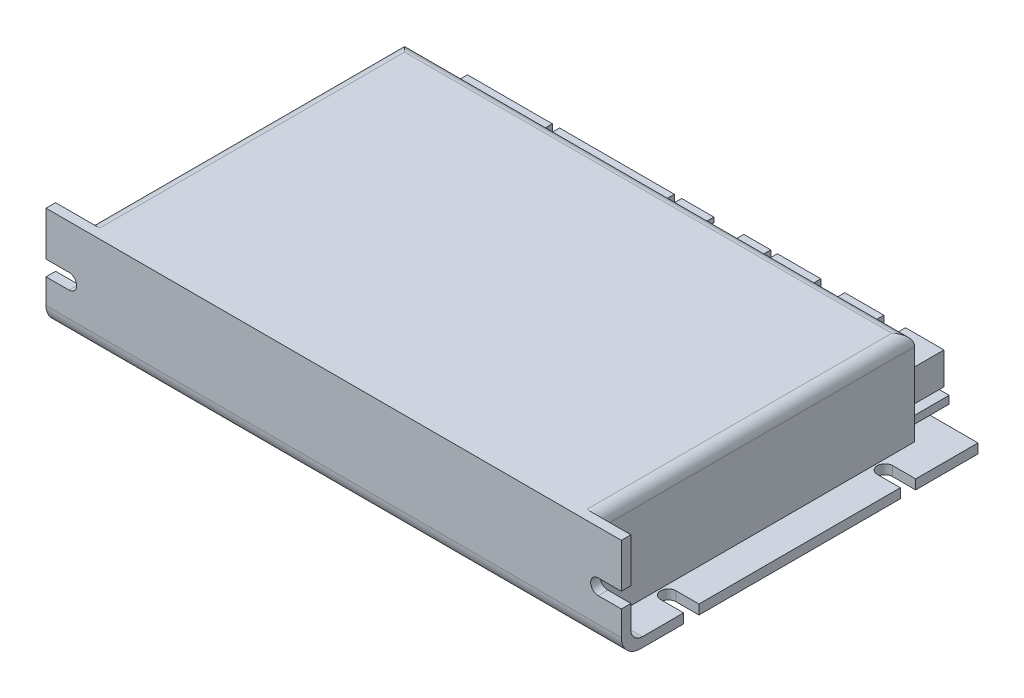
from build123d import *

# Parameters (mm, degrees)
SKETCH1_W           = 150
SKETCH1_H           = 93
EXTRUDE1_DEPTH      = 27
CUT_EXTRUDE1_DEPTH  = 24.5
CUT_EXTRUDE2_DEPTH  = 24.5
CUT_EXTRUDE3_DEPTH  = 24.5
FILLET1_R           = 5
FILLET2_R           = 3
SKETCH5_W           = 131
SKETCH5_H           = 16.5
CUT_EXTRUDE4_DEPTH  = 10
SKETCH6_W           = 14
SKETCH6_H           = 11
SKETCH6_W_2         = 44.5
CUT_EXTRUDE5_DEPTH  = 10
FILLET3_R           = 3
EXTRUDE3_DEPTH      = 1
EXTRUDE3_DEPTH_BACK = 10
SKETCH7_W           = 10
SKETCH7_H           = 7.5
SKETCH7_W_2         = 9.046304271
SKETCH7_W_3         = 9.441343418
SKETCH7_W_4         = 21.25
EXTRUDE6_DEPTH      = 10
EXTRUDE6_DEPTH_BACK = 3
SKETCH8_W           = 131
SKETCH8_H           = 2
SKETCH8_W_2         = 10.022421915
SKETCH8_H_2         = 8.333056229
SKETCH8_W_3         = 22.129060208
SKETCH8_W_4         = 10.185564029
SKETCH8_W_5         = 29.943982186
SKETCH8_W_6         = 11.333887955
SKETCH8_W_7         = 23.227827516
SKETCH9_W           = 2.603467903
SKETCH9_H           = 2.496021275
SKETCH9_W_2         = 2.603467902
CUT_EXTRUDE6_DEPTH  = 4
SKETCH10_W          = 2.603467902
SKETCH10_H          = 2.496021275
SKETCH10_W_2        = 2.603467903
CUT_EXTRUDE7_DEPTH  = 4


with BuildPart() as part:
    # Sketch1 → Extrude1 (new body)
    with BuildSketch(Plane(origin=(0, 0, 0), x_dir=(1, 0, 0), z_dir=(0, 1, 0))):
        with Locations((75, 46.5)):
            Rectangle(SKETCH1_W, SKETCH1_H)
    extrude(amount=EXTRUDE1_DEPTH)

    # Sketch2 → Cut-Extrude1 (cut)
    with BuildSketch(Plane(origin=(0, 27, 0), x_dir=(-1, 0, 0), z_dir=(0, 1, 0))):
        Polygon((-141.5, -93), (-8.5, -93), (0, -93), (0, -2.5), (-8.5, -2.5), (-8.5, -85), (-141.5, -85), (-141.5, -2.5), (-150, -2.5), (-150, -93), align=None)
    extrude(amount=-CUT_EXTRUDE1_DEPTH, mode=Mode.SUBTRACT)

    # Sketch3 → Cut-Extrude2 (cut)
    with BuildSketch(Plane.XY):
        with BuildLine():
            Line((150, 15.5), (150, 11.5))
            Line((150, 11.5), (144, 11.5))
            ThreePointArc((144, 11.5), (142, 13.5), (144, 15.5))
            Line((144, 15.5), (150, 15.5))
        make_face()
        with BuildLine():
            Line((6, 15.5), (0, 15.5))
            Line((0, 15.5), (0, 11.5))
            Line((0, 11.5), (6, 11.5))
            ThreePointArc((6, 11.5), (8, 13.5), (6, 15.5))
        make_face()
    extrude(amount=-CUT_EXTRUDE2_DEPTH, mode=Mode.SUBTRACT)

    # Sketch4 → Cut-Extrude3 (cut)
    with BuildSketch(Plane.XZ):
        with BuildLine():
            Line((6, -16.25), (0, -16.25))
            Line((0, -16.25), (0, -20.25))
            Line((0, -20.25), (6, -20.25))
            ThreePointArc((6, -20.25), (8, -18.25), (6, -16.25))
        make_face()
        with BuildLine():
            Line((144, -76.75), (150, -76.75))
            Line((150, -76.75), (150, -72.75))
            Line((150, -72.75), (144, -72.75))
            ThreePointArc((144, -72.75), (142, -74.75), (144, -76.75))
        make_face()
        with BuildLine():
            Line((0, -76.75), (0, -72.75))
            Line((0, -72.75), (6, -72.75))
            ThreePointArc((6, -72.75), (8, -74.75), (6, -76.75))
            Line((6, -76.75), (0, -76.75))
        make_face()
        with BuildLine():
            Line((150, -16.25), (150, -20.25))
            Line((150, -20.25), (144, -20.25))
            ThreePointArc((144, -20.25), (142, -18.25), (144, -16.25))
            Line((144, -16.25), (150, -16.25))
        make_face()
    extrude(amount=-CUT_EXTRUDE3_DEPTH, mode=Mode.SUBTRACT)

    # Fillet1
    fillet1_edges = [part.edges().sort_by_distance(p)[0] for p in [
        (75, 0, 0),
    ]]
    fillet(fillet1_edges, radius=FILLET1_R)

    # Fillet2
    fillet2_edges = [part.edges().sort_by_distance(p)[0] for p in [
        (141.5, 27, -43.75),
        (8.5, 27, -43.75),
        (75, 27, -85),
    ]]
    fillet(fillet2_edges, radius=FILLET2_R)

    # Sketch5 → Cut-Extrude4 (cut)
    with BuildSketch(Plane(origin=(0, 0, -85), x_dir=(-1, 0, 0), z_dir=(0, 0, -1))):
        with Locations((-75, 10.75)):
            Rectangle(SKETCH5_W, SKETCH5_H)
    extrude(amount=-CUT_EXTRUDE4_DEPTH, mode=Mode.SUBTRACT)

    # Sketch6 → Cut-Extrude5 (cut)
    with BuildSketch(Plane.ZY.offset(-8.5)):
        with Locations((-72, 13.5)):
            Rectangle(SKETCH6_W, SKETCH6_H)
        with Locations((-30.75, 13.5)):
            Rectangle(SKETCH6_W_2, SKETCH6_H)
    extrude(amount=-CUT_EXTRUDE5_DEPTH, mode=Mode.SUBTRACT)

    # Fillet3
    fillet3_edges = [part.edges().sort_by_distance(p)[0] for p in [
        (145.75, 2.5, -2.5),
        (4.25, 2.5, -2.5),
    ]]
    fillet(fillet3_edges, radius=FILLET3_R)

    # Sketch7 → Extrude3 (add, two sides: drawn at the far end of the back side and taken through both)
    with BuildSketch(Plane.ZY.offset(-8.5).offset(-EXTRUDE3_DEPTH_BACK)):
        with Locations((-72, 12.75)):
            Rectangle(SKETCH7_W, SKETCH7_H)
        with Locations((-47.476847865, 12.75)):
            Rectangle(SKETCH7_W_2, SKETCH7_H)
        with Locations((-36.814452533, 12.75)):
            Rectangle(SKETCH7_W_3, SKETCH7_H)
        with Locations((-20.125, 12.75)):
            Rectangle(SKETCH7_W_4, SKETCH7_H)
    extrude(amount=EXTRUDE3_DEPTH + EXTRUDE3_DEPTH_BACK)

    # Sketch8 → Extrude6 (add, two sides: drawn at the far end of the back side and taken through both)
    with BuildSketch(Plane(origin=(0, 0, -85), x_dir=(-1, 0, 0), z_dir=(0, 0, -1)).offset(-EXTRUDE6_DEPTH_BACK)):
        with Locations((-75, 6.5)):
            Rectangle(SKETCH8_W, SKETCH8_H)
        with Locations((-134.116596711, 12.895075454)):
            Rectangle(SKETCH8_W_2, SKETCH8_H_2)
        with Locations((-25.958034722, 12.895075454)):
            Rectangle(SKETCH8_W_3, SKETCH8_H_2)
        with Locations((-118.373880477, 12.895075454)):
            Rectangle(SKETCH8_W_4, SKETCH8_H_2)
        with Locations((-53.870994704, 12.895075454)):
            Rectangle(SKETCH8_W_5, SKETCH8_H_2)
        with Locations((-101.357677139, 12.895075454)):
            Rectangle(SKETCH8_W_6, SKETCH8_H_2)
        with Locations((-82.352152151, 12.895075454)):
            Rectangle(SKETCH8_W_7, SKETCH8_H_2)
    extrude(amount=EXTRUDE6_DEPTH + EXTRUDE6_DEPTH_BACK)


with BuildPart() as extrude6_piece_1:
    # of the separate pieces the step leaves, piece 1, a body of its own (extrude6_pieces)
    add(part.part.solids().sort_by_distance((141.5, 5.5, -2.5))[0])

    # Sketch9 → Cut-Extrude6 (cut)
    with BuildSketch(Plane.ZY.offset(-7.5)):
        with Locations((-72.014908568, 14.51777705)):
            Rectangle(SKETCH9_W, SKETCH9_H)
        with Locations((-69.014908568, 14.51777705)):
            Rectangle(SKETCH9_W, SKETCH9_H)
        with Locations((-75.014908568, 14.51777705)):
            Rectangle(SKETCH9_W, SKETCH9_H)
        with Locations((-75.014908568, 11.01777705)):
            Rectangle(SKETCH9_W, SKETCH9_H)
        with Locations((-72.014908568, 11.01777705)):
            Rectangle(SKETCH9_W, SKETCH9_H)
        with Locations((-69.014908568, 11.01777705)):
            Rectangle(SKETCH9_W, SKETCH9_H)
        with Locations((-45.769219331, 14.51777705)):
            Rectangle(SKETCH9_W_2, SKETCH9_H)
        with Locations((-48.769219331, 14.51777705)):
            Rectangle(SKETCH9_W_2, SKETCH9_H)
        with Locations((-48.769219331, 11.01777705)):
            Rectangle(SKETCH9_W_2, SKETCH9_H)
        with Locations((-45.769219331, 11.01777705)):
            Rectangle(SKETCH9_W_2, SKETCH9_H)
        with Locations((-35.292131588, 14.51777705)):
            Rectangle(SKETCH9_W_2, SKETCH9_H)
        with Locations((-38.292131588, 14.51777705)):
            Rectangle(SKETCH9_W_2, SKETCH9_H)
        with Locations((-38.292131588, 11.01777705)):
            Rectangle(SKETCH9_W_2, SKETCH9_H)
        with Locations((-35.292131588, 11.01777705)):
            Rectangle(SKETCH9_W_2, SKETCH9_H)
    extrude(amount=-CUT_EXTRUDE6_DEPTH, mode=Mode.SUBTRACT)


with BuildPart() as extrude6_piece_2:
    # of the separate pieces the step leaves, piece 2, a body of its own (extrude6_pieces)
    add(part.part.solids().sort_by_distance((68.842985797, 8.728547339, -95))[0])


with BuildPart() as extrude6_piece_3:
    # of the separate pieces the step leaves, piece 3, a body of its own (extrude6_pieces)
    add(part.part.solids().sort_by_distance((93.966065909, 8.728547339, -95))[0])


with BuildPart() as extrude6_piece_4:
    # of the separate pieces the step leaves, piece 4, a body of its own (extrude6_pieces)
    add(part.part.solids().sort_by_distance((37.022564826, 8.728547339, -95))[0])


with BuildPart() as extrude6_piece_5:
    # of the separate pieces the step leaves, piece 5, a body of its own (extrude6_pieces)
    add(part.part.solids().sort_by_distance((107.024621117, 17.061603568, -95))[0])


with BuildPart() as extrude6_piece_6:
    # of the separate pieces the step leaves, piece 6, a body of its own (extrude6_pieces)
    add(part.part.solids().sort_by_distance((123.466662491, 17.061603568, -95))[0])


with BuildPart() as extrude6_piece_7:
    # of the separate pieces the step leaves, piece 7, a body of its own (extrude6_pieces)
    add(part.part.solids().sort_by_distance((139.127807668, 17.061603568, -95))[0])


with BuildPart() as cut_extrude7_tool:
    # Sketch10 → Cut-Extrude7 (new body)
    with BuildSketch(Plane(origin=(61.225006219, -0.339140366, -95), x_dir=(-1, 0, 0), z_dir=(0, 0, -1))):
        with Locations((-71.299626813, 14.861536365)):
            Rectangle(SKETCH10_W, SKETCH10_H)
        with Locations((-55.730454196, 14.861536365)):
            Rectangle(SKETCH10_W_2, SKETCH10_H)
        with Locations((-74.299626813, 14.861536365)):
            Rectangle(SKETCH10_W, SKETCH10_H)
        with Locations((-74.299626813, 11.361536365)):
            Rectangle(SKETCH10_W, SKETCH10_H)
        with Locations((-71.299626813, 11.361536365)):
            Rectangle(SKETCH10_W, SKETCH10_H)
        with Locations((-58.730454196, 14.861536365)):
            Rectangle(SKETCH10_W_2, SKETCH10_H)
        with Locations((-58.730454196, 11.361536365)):
            Rectangle(SKETCH10_W_2, SKETCH10_H)
        with Locations((-55.730454196, 11.361536365)):
            Rectangle(SKETCH10_W_2, SKETCH10_H)
        with Locations((-40.41576118, 14.861536365)):
            Rectangle(SKETCH10_W, SKETCH10_H)
        with Locations((-43.41576118, 14.861536365)):
            Rectangle(SKETCH10_W, SKETCH10_H)
        with Locations((-43.41576118, 11.361536365)):
            Rectangle(SKETCH10_W, SKETCH10_H)
        with Locations((-40.41576118, 11.361536365)):
            Rectangle(SKETCH10_W, SKETCH10_H)
        with Locations((-36.91576118, 14.861536365)):
            Rectangle(SKETCH10_W, SKETCH10_H)
        with Locations((-36.91576118, 11.361536365)):
            Rectangle(SKETCH10_W, SKETCH10_H)
        with Locations((-4.744589905, 14.861536365)):
            Rectangle(SKETCH10_W, SKETCH10_H)
        with Locations((-4.744589905, 11.361536365)):
            Rectangle(SKETCH10_W, SKETCH10_H)
        with Locations((-1.244589905, 14.861536365)):
            Rectangle(SKETCH10_W, SKETCH10_H)
        with Locations((-1.244589905, 11.361536365)):
            Rectangle(SKETCH10_W, SKETCH10_H)
        with Locations((2.255410095, 14.861536365)):
            Rectangle(SKETCH10_W, SKETCH10_H)
        with Locations((2.255410095, 11.361536365)):
            Rectangle(SKETCH10_W, SKETCH10_H)
        with Locations((5.755410095, 14.861536365)):
            Rectangle(SKETCH10_W, SKETCH10_H)
        with Locations((5.755410095, 11.361536365)):
            Rectangle(SKETCH10_W, SKETCH10_H)
        with Locations((9.255410095, 14.861536365)):
            Rectangle(SKETCH10_W, SKETCH10_H)
        with Locations((9.255410095, 11.361536365)):
            Rectangle(SKETCH10_W, SKETCH10_H)
        with Locations((12.755410095, 14.861536365)):
            Rectangle(SKETCH10_W, SKETCH10_H)
        with Locations((12.755410095, 11.361536365)):
            Rectangle(SKETCH10_W, SKETCH10_H)
        with Locations((16.255410095, 14.861536365)):
            Rectangle(SKETCH10_W, SKETCH10_H)
        with Locations((16.255410095, 11.361536365)):
            Rectangle(SKETCH10_W, SKETCH10_H)
        with Locations((19.755410095, 14.861536365)):
            Rectangle(SKETCH10_W, SKETCH10_H)
        with Locations((19.755410095, 11.361536365)):
            Rectangle(SKETCH10_W, SKETCH10_H)
        with Locations((26.5803472, 14.999981419)):
            Rectangle(SKETCH10_W, SKETCH10_H)
        with Locations((26.5803472, 11.499981419)):
            Rectangle(SKETCH10_W, SKETCH10_H)
        with Locations((30.0803472, 14.999981419)):
            Rectangle(SKETCH10_W, SKETCH10_H)
        with Locations((30.0803472, 11.499981419)):
            Rectangle(SKETCH10_W, SKETCH10_H)
        with Locations((33.5803472, 14.999981419)):
            Rectangle(SKETCH10_W, SKETCH10_H)
        with Locations((33.5803472, 11.499981419)):
            Rectangle(SKETCH10_W, SKETCH10_H)
        with Locations((37.0803472, 14.999981419)):
            Rectangle(SKETCH10_W, SKETCH10_H)
        with Locations((37.0803472, 11.499981419)):
            Rectangle(SKETCH10_W, SKETCH10_H)
        with Locations((40.5803472, 14.999981419)):
            Rectangle(SKETCH10_W, SKETCH10_H)
        with Locations((40.5803472, 11.499981419)):
            Rectangle(SKETCH10_W, SKETCH10_H)
        with Locations((44.0803472, 14.999981419)):
            Rectangle(SKETCH10_W, SKETCH10_H)
        with Locations((44.0803472, 11.499981419)):
            Rectangle(SKETCH10_W, SKETCH10_H)
        Polygon((-25.714614074, 16.109547002), (-31.548644145, 16.109547002), (-31.548644145, 10.113525727), (-11.183672128, 10.113525727), (-11.183672128, 16.109547002), (-17.908628411, 16.109547002), (-17.908628411, 17.400743935), (-25.714614074, 17.400743935), align=None)
    extrude(amount=-CUT_EXTRUDE7_DEPTH)


with BuildPart() as extrude6_piece_2_1:
    add(extrude6_piece_2.part)

    # Cut-Extrude7: cut by cut_extrude7_tool
    add(cut_extrude7_tool.part, mode=Mode.SUBTRACT)


with BuildPart() as extrude6_piece_3_1:
    add(extrude6_piece_3.part)

    # Cut-Extrude7: cut by cut_extrude7_tool
    add(cut_extrude7_tool.part, mode=Mode.SUBTRACT)


with BuildPart() as extrude6_piece_4_1:
    add(extrude6_piece_4.part)

    # Cut-Extrude7: cut by cut_extrude7_tool
    add(cut_extrude7_tool.part, mode=Mode.SUBTRACT)


with BuildPart() as extrude6_piece_5_1:
    add(extrude6_piece_5.part)

    # Cut-Extrude7: cut by cut_extrude7_tool
    add(cut_extrude7_tool.part, mode=Mode.SUBTRACT)


with BuildPart() as extrude6_piece_6_1:
    add(extrude6_piece_6.part)

    # Cut-Extrude7: cut by cut_extrude7_tool
    add(cut_extrude7_tool.part, mode=Mode.SUBTRACT)


with BuildPart() as extrude6_piece_7_1:
    add(extrude6_piece_7.part)

    # Cut-Extrude7: cut by cut_extrude7_tool
    add(cut_extrude7_tool.part, mode=Mode.SUBTRACT)


solid = Compound([extrude6_piece_1.part, extrude6_piece_2_1.part, extrude6_piece_3_1.part, extrude6_piece_4_1.part, extrude6_piece_5_1.part, extrude6_piece_6_1.part, extrude6_piece_7_1.part])
